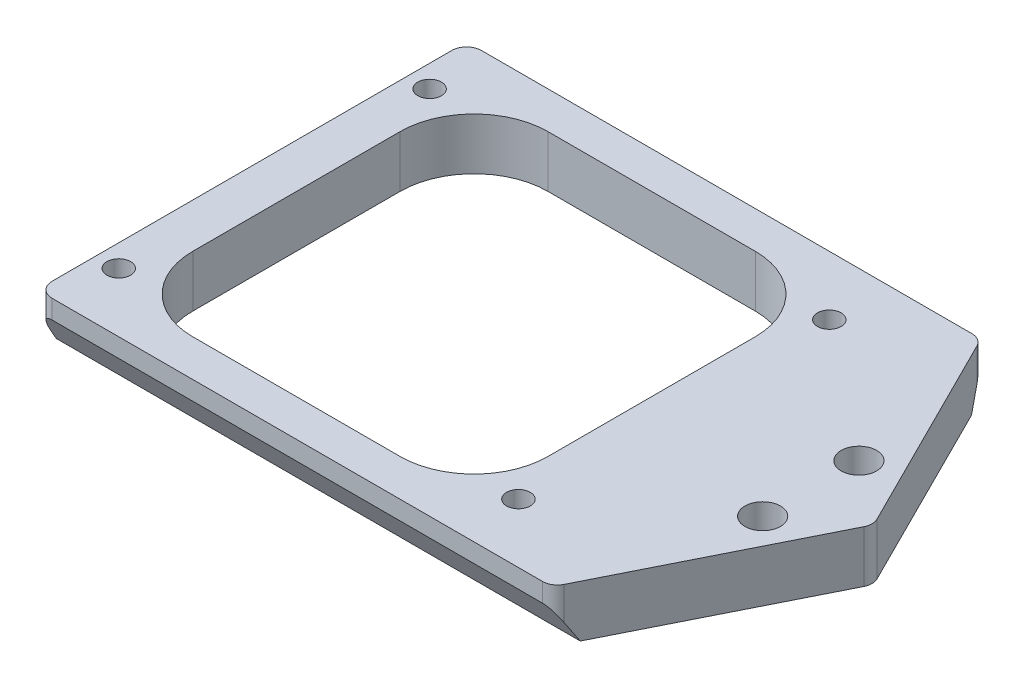
from build123d import *

# Parameters (mm, degrees)
BOSS_EXTRUDE1_DEPTH     = 1.75
CUT_EXTRUDE1_DEPTH      = 52.069193258
CUT_EXTRUDE1_DEPTH_BACK = 52.069193258
SKETCH2_W               = 24
SKETCH2_H               = 24
FILLET1_R               = 5
M2X0_4_TAPPED_HOLE1_D   = 1.6
FILLET2_R               = 1
SKETCH11_W              = 39.153964454
SKETCH11_H              = 3.647114317
CUT_EXTRUDE2_DEPTH      = 51.858555782
M2_CLEARANCE_HOLE2_D    = 2.4


with BuildPart() as part:
    # Sketch1 → Boss-Extrude1 (new, symmetric)
    with BuildSketch(Plane(origin=(0, 0, 0), x_dir=(1, 0, 0), z_dir=(0, 1, 0))):
        Polygon((0, 0), (34.748434417, 0), (42, 14.5), (34.748434417, 29), (0, 29), align=None)
    extrude(amount=BOSS_EXTRUDE1_DEPTH, both=True)

    # Sketch2 → Cut-Extrude1 (cut, two sides: drawn at the far end of the back side and taken through both)
    with BuildSketch(Plane(origin=(0, 0, 0), x_dir=(1, 0, 0), z_dir=(0, 1, 0)).offset(-CUT_EXTRUDE1_DEPTH_BACK)):
        with Locations((15, 14.5)):
            Rectangle(SKETCH2_W, SKETCH2_H)
    extrude(amount=CUT_EXTRUDE1_DEPTH + CUT_EXTRUDE1_DEPTH_BACK, mode=Mode.SUBTRACT)

    # Fillet1
    fillet1_edges = [part.edges().sort_by_distance(p)[0] for p in [
        (3, 0, -2.5),
        (3, 0, -26.5),
        (27, 0, -26.5),
        (27, 0, -2.5),
    ]]
    fillet(fillet1_edges, radius=FILLET1_R)

    # M2x0.4 Tapped Hole1 (through all)
    with Locations(Plane(origin=(1.5, 1.75, -25), x_dir=(0, 0, 1), z_dir=(0, 1, 0))):
        with Locations((0, 0), (0, 27), (7.25, 36.248434417), (13.75, 36.248434417), (21, 27), (21, 0)):
            Hole(M2X0_4_TAPPED_HOLE1_D / 2)

    # Fillet2
    fillet2_edges = [part.edges().sort_by_distance(p)[0] for p in [
        (0, 0, -29),
        (34.748434417, 0, -29),
        (42, 0, -14.5),
        (34.748434417, 0, 0),
        (0, 0, 0),
    ]]
    fillet(fillet2_edges, radius=FILLET2_R)

    # Sketch11 → Cut-Extrude2 (cut, through all)
    with BuildSketch(Plane(origin=(0, 0.119868355, -0.207618081), x_dir=(1, 0, 0), z_dir=(9.104401052367775e-15, -0.5000000000000047, 0.866025403784436))):
        with Locations((19.576982227, -0.335580838)):
            Rectangle(SKETCH11_W, SKETCH11_H)
    cut_extrude2 = extrude(amount=CUT_EXTRUDE2_DEPTH, mode=Mode.SUBTRACT)

    # Mirror1: Cut-Extrude2 across plane
    add(cut_extrude2.mirror(Plane(origin=(0, 0, -14.5), x_dir=(1, 0, 0), z_dir=(0, 0, -1))), mode=Mode.SUBTRACT)

    # M2 Clearance Hole2 (through all)
    with Locations(Plane(origin=(37.748434417, 1.75, -17.75), x_dir=(0, 0, 1), z_dir=(0, 1, 0))):
        with Locations((0, 0), (6.5, 0)):
            Hole(M2_CLEARANCE_HOLE2_D / 2)


solid = part.part
